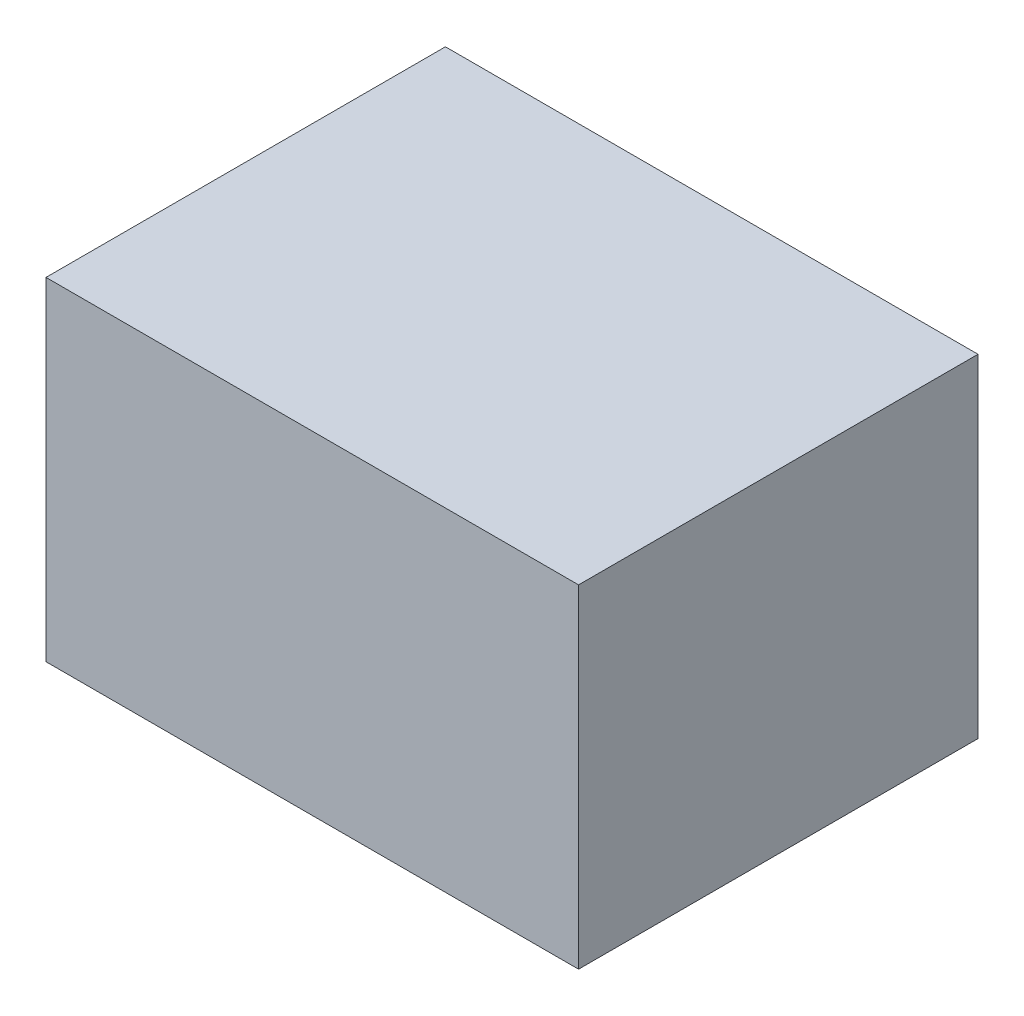
from build123d import *

# Parameters (mm, degrees)
SKETCH1_W               = 1.999996
SKETCH1_H               = 1.2500102
COMPONENT_OUTLINE_DEPTH = 1.499997


with BuildPart() as part:
    # Sketch1 → Component_Outline (new body)
    with BuildSketch(Plane.XY):
        with Locations((0, -0.0250063)):
            Rectangle(SKETCH1_W, SKETCH1_H)
    extrude(amount=COMPONENT_OUTLINE_DEPTH)


solid = part.part
